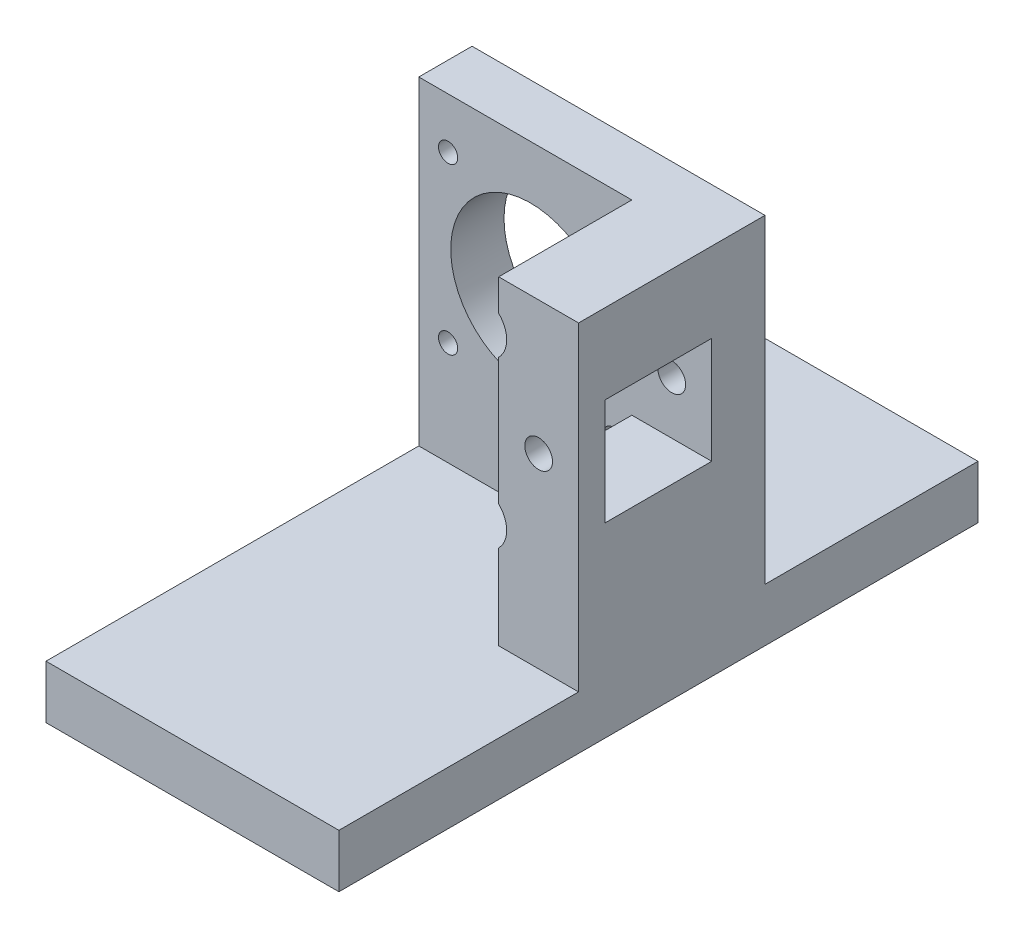
from build123d import *

# Parameters (mm, degrees)
SKETCH4_W               = 40
SKETCH4_H               = 80
BOSS_EXTRUDE4_DEPTH     = 5
SKETCH5_W               = 10
SKETCH5_H               = 5
BOSS_EXTRUDE6_DEPTH     = 50
SKETCH7_W               = 10
SKETCH7_H               = 25
SKETCH7_H_2             = 5
BOSS_EXTRUDE7_DEPTH     = 20
SKETCH8_W               = 40
SKETCH8_H               = 5
BOSS_EXTRUDE8_DEPTH     = 20
SKETCH9_W               = 100
SKETCH9_H               = 5
BOSS_EXTRUDE9_DEPTH     = 10
SKETCH10_W              = 5
SKETCH10_H              = 50
BOSS_EXTRUDE10_DEPTH    = 40
BOSS_EXTRUDE11_DEPTH    = 10
SKETCH12_R              = 15
SKETCH12_R_2            = 1.8
CUT_EXTRUDE1_DEPTH      = 5
CUT_EXTRUDE2_DEPTH      = 92.241437954
CUT_EXTRUDE2_DEPTH_BACK = 92.241437954
SKETCH13_R              = 2.25
SKETCH14_R              = 4
SKETCH14_R_2            = 2.25
CUT_EXTRUDE4_DEPTH      = 2
CUT_EXTRUDE5_START      = -2
SKETCH15_R              = 4
SKETCH15_R_2            = 2.25
CUT_EXTRUDE5_DEPTH      = 2
SKETCH17_R              = 5
CUT_EXTRUDE6_DEPTH      = 25
SKETCH19_W              = 50
SKETCH19_H              = 60
SKETCH19_R              = 1.8
SKETCH19_R_2            = 15
SKETCH19_R_3            = 4
BOSS_EXTRUDE13_DEPTH    = 5
SKETCH20_R              = 4
SKETCH20_R_2            = 2.25
BOSS_EXTRUDE14_DEPTH    = 5
SKETCH21_W              = 20
SKETCH21_H              = 20
BOSS_EXTRUDE15_DEPTH    = 5
BOSS_EXTRUDE16_START    = -10
SKETCH22_R              = 4
BOSS_EXTRUDE16_DEPTH    = 10
SKETCH23_R              = 4
BOSS_EXTRUDE17_DEPTH    = 5
CUT_EXTRUDE7_DEPTH      = 106.59356041
CUT_EXTRUDE7_DEPTH_BACK = 106.59356041
SKETCH24_R              = 2.6
SKETCH25_W              = 55
SKETCH25_H              = 100
BOSS_EXTRUDE18_DEPTH    = 5
SKETCH26_W              = 55
SKETCH26_H              = 10
BOSS_EXTRUDE19_DEPTH    = 20


with BuildPart() as part:
    # Sketch4 → Boss-Extrude4 (new body)
    with BuildSketch(Plane(origin=(0, 0, 0), x_dir=(1, 0, 0), z_dir=(0, 1, 0))):
        with Locations((20, 40)):
            Rectangle(SKETCH4_W, SKETCH4_H)
    extrude(amount=BOSS_EXTRUDE4_DEPTH)

    # Sketch5 → Boss-Extrude6 (add)
    with BuildSketch(Plane(origin=(0, 5, 0), x_dir=(1, 0, 0), z_dir=(0, 1, 0))):
        with Locations((35, 52.5)):
            Rectangle(SKETCH5_W, SKETCH5_H)
        with Locations((35, 27.5)):
            Rectangle(SKETCH5_W, SKETCH5_H)
    extrude(amount=BOSS_EXTRUDE6_DEPTH)

    # Sketch7 → Boss-Extrude7 (add)
    with BuildSketch(Plane.XY.offset(-50)):
        with Locations((35, 17.5)):
            Rectangle(SKETCH7_W, SKETCH7_H)
        with Locations((35, 52.5)):
            Rectangle(SKETCH7_W, SKETCH7_H_2)
    extrude(amount=BOSS_EXTRUDE7_DEPTH)

    # Sketch8 → Boss-Extrude8 (add)
    with BuildSketch(Plane(origin=(0, 0, -80), x_dir=(-1, 0, 0), z_dir=(0, 0, -1))):
        with Locations((-20, 2.5)):
            Rectangle(SKETCH8_W, SKETCH8_H)
    extrude(amount=BOSS_EXTRUDE8_DEPTH)

    # Sketch9 → Boss-Extrude9 (add)
    with BuildSketch(Plane.ZY):
        with Locations((-50, 2.5)):
            Rectangle(SKETCH9_W, SKETCH9_H)
    extrude(amount=BOSS_EXTRUDE9_DEPTH)

    # Sketch10 → Boss-Extrude10 (add)
    with BuildSketch(Plane.ZY.offset(-30)):
        with Locations((-52.5, 30)):
            Rectangle(SKETCH10_W, SKETCH10_H)
    extrude(amount=BOSS_EXTRUDE10_DEPTH)

    # Sketch11 → Boss-Extrude11 (add)
    with BuildSketch(Plane(origin=(0, 55, 0), x_dir=(1, 0, 0), z_dir=(0, 1, 0))):
        Polygon((40, 55), (-10, 55), (-10, 50), (30, 50), (30, 25), (40, 25), align=None)
    extrude(amount=BOSS_EXTRUDE11_DEPTH)

    # Sketch12 → Cut-Extrude1 (cut)
    with BuildSketch(Plane.XY.offset(-50)):
        with Locations((11, 40)):
            Circle(SKETCH12_R)
        with Locations((-4.499780644, 55.499780644)):
            Circle(SKETCH12_R_2)
        with Locations((26.499780644, 55.499780644)):
            Circle(SKETCH12_R_2)
        with Locations((-4.499780644, 24.500219356)):
            Circle(SKETCH12_R_2)
        with Locations((26.499780644, 24.500219356)):
            Circle(SKETCH12_R_2)
    extrude(amount=-CUT_EXTRUDE1_DEPTH, mode=Mode.SUBTRACT)

    # Sketch13 → Cut-Extrude2 (cut, two sides: drawn at the far end of the back side and taken through both)
    with BuildSketch(Plane.XY.offset(-50).offset(-CUT_EXTRUDE2_DEPTH_BACK)):
        with Locations((35, 40)):
            Circle(SKETCH13_R)
    extrude(amount=CUT_EXTRUDE2_DEPTH + CUT_EXTRUDE2_DEPTH_BACK, mode=Mode.SUBTRACT)

    # Sketch14 → Cut-Extrude4 (cut)
    with BuildSketch(Plane.XY.offset(-25)):
        with Locations((35, 40)):
            Circle(SKETCH14_R)
        with Locations((35, 40)):
            Circle(SKETCH14_R_2, mode=Mode.SUBTRACT)
    extrude(amount=-CUT_EXTRUDE4_DEPTH, mode=Mode.SUBTRACT)

    # Sketch15 → Cut-Extrude5 (cut)
    with BuildSketch(Plane(origin=(0, 0, -55), x_dir=(-1, 0, 0), z_dir=(0, 0, -1)).offset(CUT_EXTRUDE5_START)):
        with Locations(Location((-35, 40, 0), (0, 0, 180))):
            Circle(SKETCH15_R)
        with Locations(Location((-35, 40, 0), (0, 0, 180))):
            Circle(SKETCH15_R_2, mode=Mode.SUBTRACT)
    extrude(amount=CUT_EXTRUDE5_DEPTH, mode=Mode.SUBTRACT)

    # Sketch17 → Cut-Extrude6 (cut)
    with BuildSketch(Plane.XY.offset(-25)):
        with Locations((26.499780644, 55.499780644)):
            Circle(SKETCH17_R)
        with Locations((26.499780644, 24.500219356)):
            Circle(SKETCH17_R)
    extrude(amount=-CUT_EXTRUDE6_DEPTH, mode=Mode.SUBTRACT)

    # Sketch19 → Boss-Extrude13 (add)
    with BuildSketch(Plane(origin=(0, 0, -55), x_dir=(-1, 0, 0), z_dir=(0, 0, -1))):
        with Locations((-15, 35)):
            Rectangle(SKETCH19_W, SKETCH19_H)
        with Locations(Location((4.499780644, 55.499780644, 0), (0, 0, 180))):
            Circle(SKETCH19_R, mode=Mode.SUBTRACT)
        with Locations(Location((4.499780644, 24.500219356, 0), (0, 0, 180))):
            Circle(SKETCH19_R, mode=Mode.SUBTRACT)
        with Locations(Location((-26.499780644, 24.500219356, 0), (0, 0, 180))):
            Circle(SKETCH19_R, mode=Mode.SUBTRACT)
        with Locations(Location((-11, 40, 0), (0, 0, 180))):
            Circle(SKETCH19_R_2, mode=Mode.SUBTRACT)
        with Locations(Location((-35, 40, 0), (0, 0, 180))):
            Circle(SKETCH19_R_3, mode=Mode.SUBTRACT)
        with Locations(Location((-26.499780644, 55.499780644, 0), (0, 0, 180))):
            Circle(SKETCH19_R, mode=Mode.SUBTRACT)
    extrude(amount=BOSS_EXTRUDE13_DEPTH)

    # Sketch20 → Boss-Extrude14 (add)
    with BuildSketch(Plane(origin=(0, 0, -53), x_dir=(-1, 0, 0), z_dir=(0, 0, -1))):
        with Locations(Location((-35, 40, 0), (0, 0, 180))):
            Circle(SKETCH20_R)
        with Locations(Location((-35, 40, 0), (0, 0, 180))):
            Circle(SKETCH20_R_2, mode=Mode.SUBTRACT)
    extrude(amount=BOSS_EXTRUDE14_DEPTH)

    # Sketch21 → Boss-Extrude15 (add)
    with BuildSketch(Plane(origin=(40, 0, 0), x_dir=(0, 0, -1), z_dir=(1, 0, 0))):
        Polygon((100, 5), (60, 5), (60, 65), (25, 65), (25, 5), (0, 5), (0, 0), (100, 0), align=None)
        with Locations((40, 40)):
            Rectangle(SKETCH21_W, SKETCH21_H, mode=Mode.SUBTRACT)
    extrude(amount=BOSS_EXTRUDE15_DEPTH)

    # Sketch22 → Boss-Extrude16 (add)
    with BuildSketch(Plane(origin=(0, 0, -60), x_dir=(-1, 0, 0), z_dir=(0, 0, -1)).offset(BOSS_EXTRUDE16_START)):
        with Locations(Location((-35, 40, 0), (0, 0, 180))):
            Circle(SKETCH22_R)
    extrude(amount=BOSS_EXTRUDE16_DEPTH)

    # Sketch23 → Boss-Extrude17 (add)
    with BuildSketch(Plane.XY.offset(-25)):
        with Locations((35, 40)):
            Circle(SKETCH23_R)
    extrude(amount=-BOSS_EXTRUDE17_DEPTH)

    # Sketch24 → Cut-Extrude7 (cut, two sides: drawn at the far end of the back side and taken through both)
    with BuildSketch(Plane(origin=(0, 0, -30), x_dir=(-1, 0, 0), z_dir=(0, 0, -1)).offset(-CUT_EXTRUDE7_DEPTH_BACK)):
        with Locations((-37.5, 40)):
            Circle(SKETCH24_R)
    extrude(amount=CUT_EXTRUDE7_DEPTH + CUT_EXTRUDE7_DEPTH_BACK, mode=Mode.SUBTRACT)

    # Sketch25 → Boss-Extrude18 (add)
    with BuildSketch(Plane.XZ):
        with Locations((17.5, -50)):
            Rectangle(SKETCH25_W, SKETCH25_H)
    extrude(amount=BOSS_EXTRUDE18_DEPTH)

    # Sketch26 → Boss-Extrude19 (add)
    with BuildSketch(Plane.XY):
        with Locations((17.5, 0)):
            Rectangle(SKETCH26_W, SKETCH26_H)
    extrude(amount=BOSS_EXTRUDE19_DEPTH)


solid = part.part
